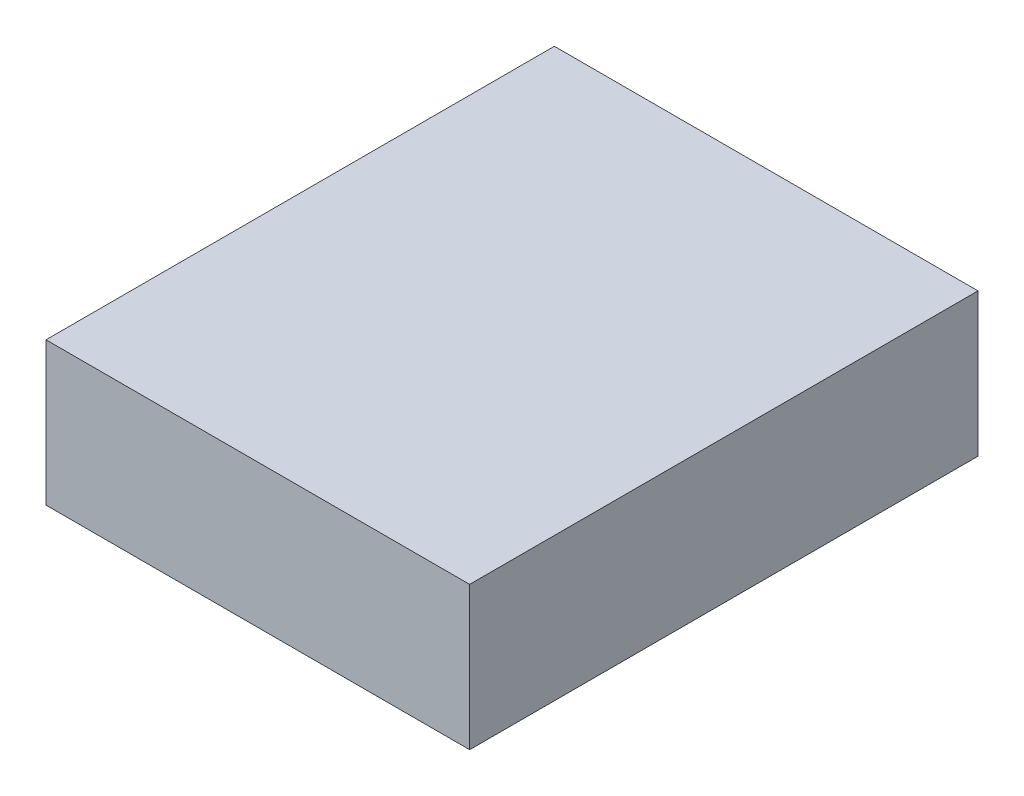
from build123d import *

# Parameters (mm, degrees)
SKETCH1_W           = 50
SKETCH1_H           = 16.9
BOSS_EXTRUDE1_DEPTH = 60


with BuildPart() as part:
    # Sketch1 → Boss-Extrude1 (new body)
    with BuildSketch(Plane.XY):
        Rectangle(SKETCH1_W, SKETCH1_H)
    extrude(amount=BOSS_EXTRUDE1_DEPTH)


solid = part.part
